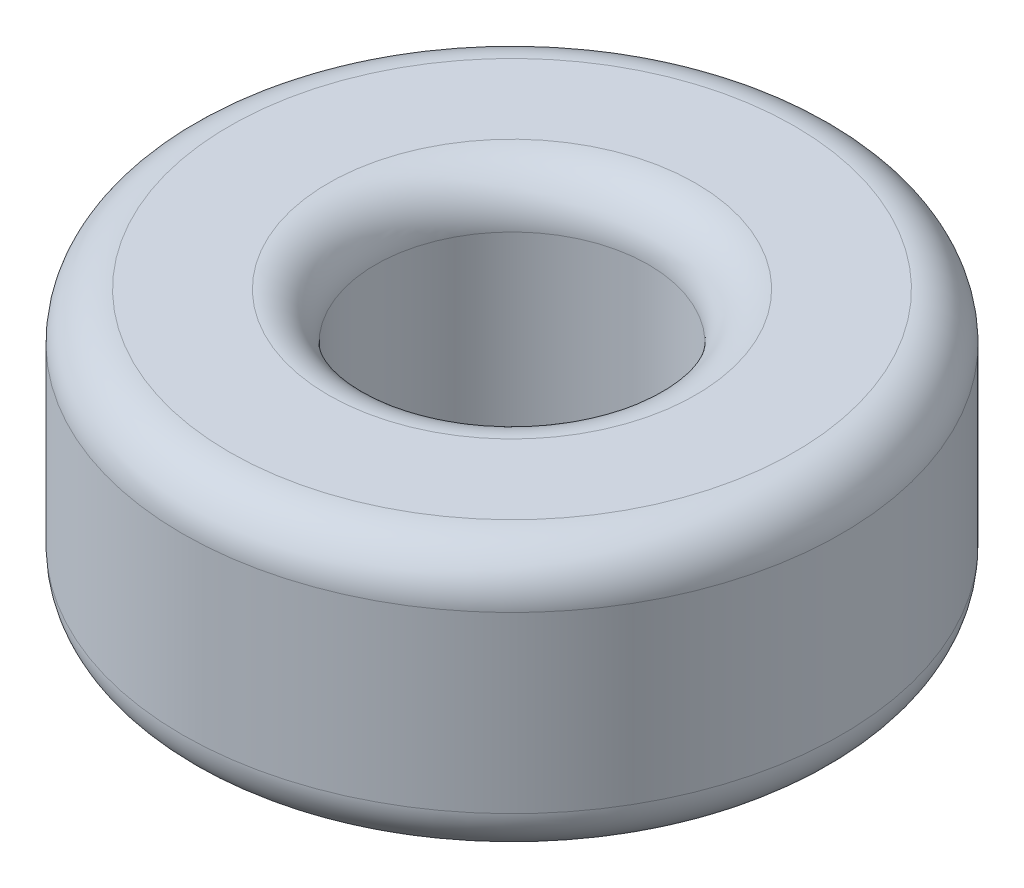
from build123d import *

# Parameters (mm, degrees)
SKETCH1_R           = 70
SKETCH1_R_2         = 29
BOSS_EXTRUDE1_DEPTH = 57
FILLET1_R           = 10
FILLET2_R           = 10
FILLET3_R           = 10
FILLET4_R           = 10


with BuildPart() as part:
    # Sketch1 → Boss-Extrude1 (new body)
    with BuildSketch(Plane(origin=(0, 0, 0), x_dir=(1, 0, 0), z_dir=(0, 1, 0))):
        with Locations(Location((0, 0, 0), (0, 0, 90))):
            Circle(SKETCH1_R)
        with Locations(Location((0, 0, 0), (0, 0, 90))):
            Circle(SKETCH1_R_2, mode=Mode.SUBTRACT)
    extrude(amount=BOSS_EXTRUDE1_DEPTH)

    # Fillet1
    fillet1_edges = [part.edges().sort_by_distance(p)[0] for p in [
        (0, 57, 70),
    ]]
    fillet(fillet1_edges, radius=FILLET1_R)

    # Fillet2
    fillet2_edges = [part.edges().sort_by_distance(p)[0] for p in [
        (0, 0, 70),
    ]]
    fillet(fillet2_edges, radius=FILLET2_R)

    # Fillet3
    fillet3_edges = [part.edges().sort_by_distance(p)[0] for p in [
        (0, 57, 29),
    ]]
    fillet(fillet3_edges, radius=FILLET3_R)

    # Fillet4
    fillet4_edges = [part.edges().sort_by_distance(p)[0] for p in [
        (0, 0, 29),
    ]]
    fillet(fillet4_edges, radius=FILLET4_R)


solid = part.part
